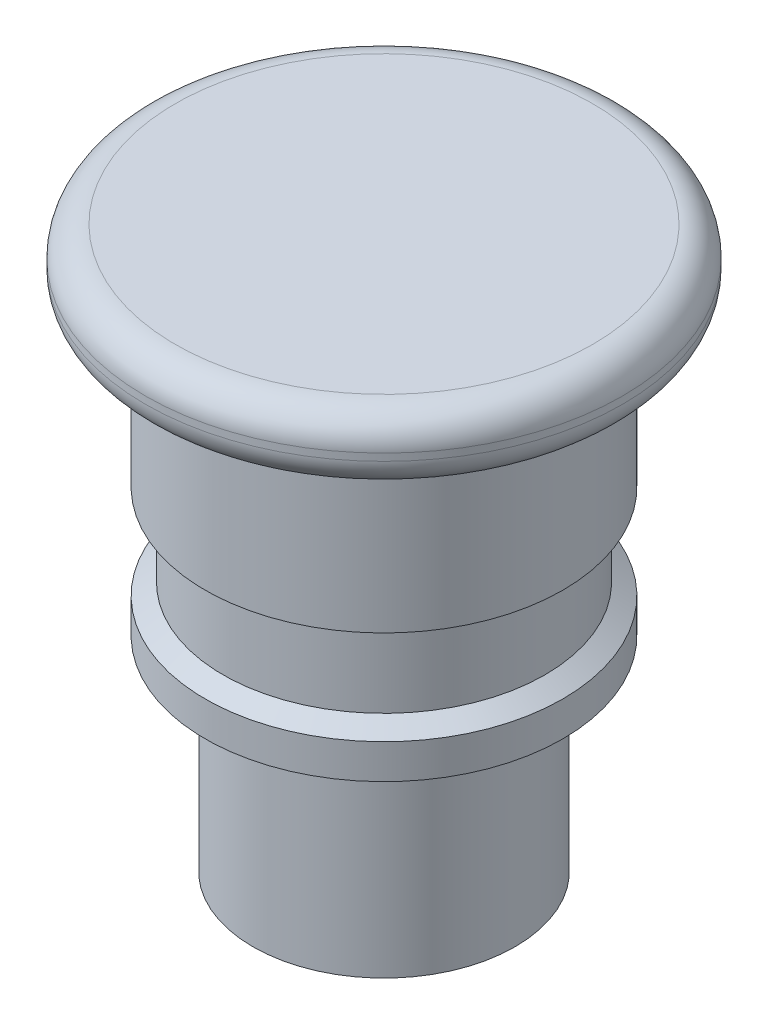
from build123d import *

# Parameters (mm, degrees)
FILLET1_R = 2.5


with BuildPart() as part:
    # Sketch1 → Revolve1 (revolve)
    with BuildSketch(Plane.XY, mode=Mode.PRIVATE) as revolve1_sk:
        Polygon((0, 29.9), (20, 29.9), (20, 24.3), (15, 24.3), (15, 10.8), (13.5, 10.8), (13.5, 3.9), (15, 2.9), (15, 0), (11, 0), (11, -17.1), (0, -17.1), align=None)
    revolve(revolve1_sk.sketch.rotate(Axis((0, 11.846060729, 0), (0, -1, 0)), 180), axis=Axis((0, 11.846060729, 0), (0, -1, 0)))

    # Fillet1
    fillet1_edges = [part.edges().sort_by_distance(p)[0] for p in [
        (20, 24.3, 0),
        (20, 29.9, 0),
    ]]
    fillet(fillet1_edges, radius=FILLET1_R)


solid = part.part
